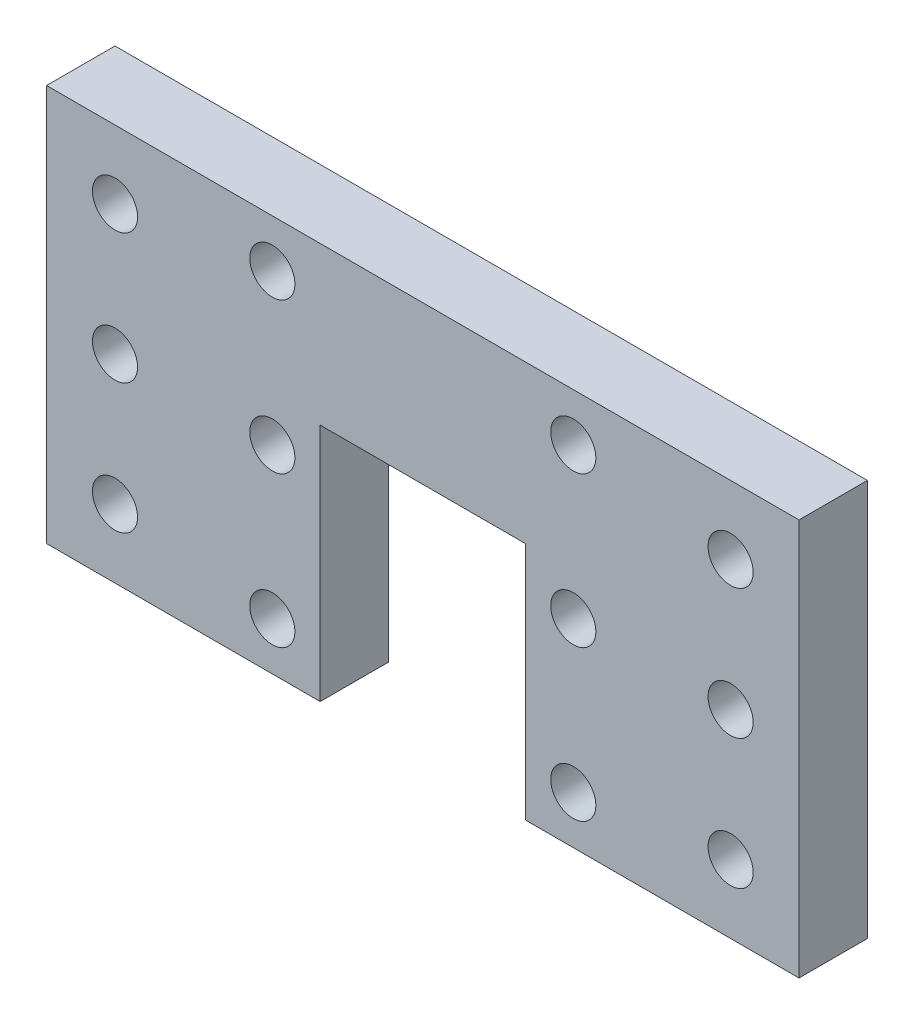
from build123d import *

# Parameters (mm, degrees)
BOSS_EXTRUDE1_DEPTH = 10
M6_CLEARANCE_HOLE_D = 6.6


with BuildPart() as part:
    # Sketch1 → Boss-Extrude1 (new body)
    with BuildSketch(Plane.XY):
        Polygon((55, 0), (15, 0), (15, 35), (-15, 35), (-15, 0), (-55, 0), (-55, 58), (55, 58), align=None)
    extrude(amount=BOSS_EXTRUDE1_DEPTH)

    # M6 Clearance Hole (through all)
    with Locations(Plane(origin=(559.845790405, 1460.886073068, 10), x_dir=(-1, 0, 0), z_dir=(0, 0, 1))):
        with Locations((514.845790405, 1450.886073068), (514.845790405, 1412.886073068), (537.845790405, 1453.886073068), (537.845790405, 1409.886073068), (581.845790405, 1453.886073068), (581.845790405, 1409.886073068), (604.845790405, 1450.886073068), (604.845790405, 1412.886073068), (514.845790405, 897.471608895), (537.845790405, 897.471608895), (581.845790405, 897.471608895), (604.845790405, 897.471608895), (394.752371414, 1482.156083565), (514.845790405, 1431.886073068), (537.845790405, 1431.886073068), (581.845790405, 1431.886073068), (604.845790405, 1431.886073068)):
            Hole(M6_CLEARANCE_HOLE_D / 2)


solid = part.part
